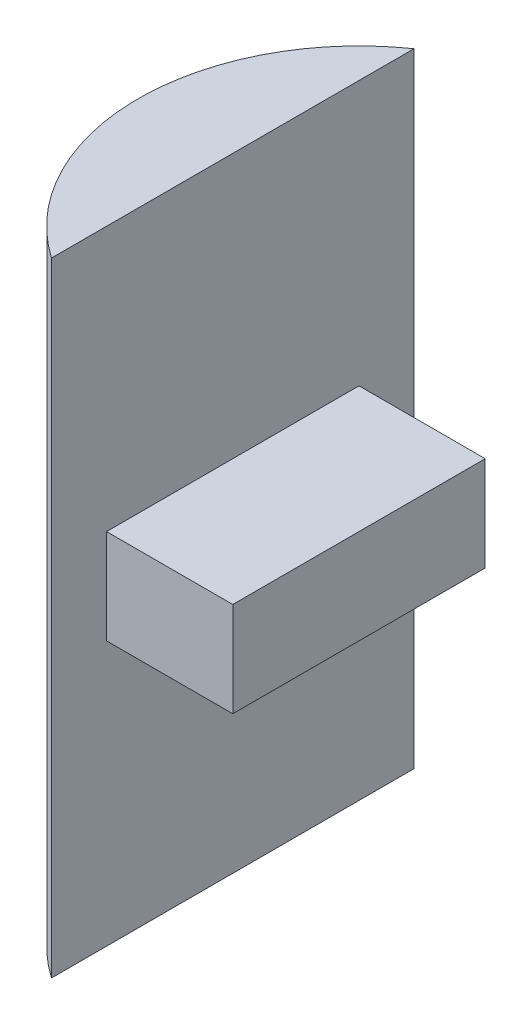
from build123d import *

# Parameters (mm, degrees)
SKETCH_1_R               = 2.5
EXTRUDE_1_DEPTH          = 23.88
SKETCH_2_R               = 1
EXTRUDE_2_DEPTH          = 1
CUT_EXTRUDE_1_DEPTH      = 5
CUT_EXTRUDE_START        = 18.88
CUT_EXTRUDE_2_DEPTH      = 5
SKETCH_6_R               = 0.25
CUT_EXTRUDE_3_DEPTH      = 0.25
CUT_EXTRUDE_START_2      = 5.25
SKETCH_7_R               = 0.25
CUT_EXTRUDE_4_DEPTH      = 0.25
EXTRUDE_START            = 7
SKETCH_17_R              = 3.5
EXTRUDE_5_DEPTH          = 9.88
CUT_EXTRUDE_6_DEPTH      = 26.937509518
CUT_EXTRUDE_6_DEPTH_BACK = 26.937509518
SKETCH_20_OUTSIDE_W      = 20.616
SKETCH_20_OUTSIDE_H      = 31.496
SKETCH_20_OUTSIDE_W_2    = 7
SKETCH_20_OUTSIDE_H_2    = 9.88
CUT_EXTRUDE_7_DEPTH      = 18.590747568
CUT_EXTRUDE_7_DEPTH_BACK = 18.590747568
SKETCH_22_W              = 5.5
SKETCH_22_H              = 9.88
EXTRUDE_START_2          = -2
SKETCH_24_W              = 4
SKETCH_24_H              = 1.5
EXTRUDE_6_DEPTH          = 2


with BuildPart() as part:
    # 草图1 → 凸台-拉伸1 (new body)
    with BuildSketch(Plane(origin=(0, 0, 0), x_dir=(1, 0, 0), z_dir=(0, 1, 0))):
        with Locations(Location((0, 0, 0), (0, 0, 90))):
            Circle(SKETCH_1_R)
    extrude(amount=EXTRUDE_1_DEPTH)

    # 草图2 → 凸台-拉伸2 (add)
    with BuildSketch(Plane(origin=(0, 0, 0), x_dir=(1, 0, 0), z_dir=(0, 1, 0))):
        with BuildLine():
            Line((0.166666667, 2.494438258), (7.633333333, 1.995550606))
            ThreePointArc((7.633333333, 1.995550606), (9.5, 0), (7.633333333, -1.995550606))
            Line((7.633333333, -1.995550606), (0.166666667, -2.494438258))
            ThreePointArc((0.166666667, -2.494438258), (-2.5, 0), (0.166666667, 2.494438258))
        make_face()
        with Locations(Location((7.5, 0, 0), (0, 0, 270))):
            Circle(SKETCH_2_R, mode=Mode.SUBTRACT)
    extrude(amount=EXTRUDE_2_DEPTH)

    # 草图3 → 切除-拉伸1 (cut)
    with BuildSketch(Plane(origin=(0, 0, 0), x_dir=(1, 0, 0), z_dir=(0, 1, 0))):
        with BuildLine():
            Line((-1.854049622, -0.75), (-0.75, -0.75))
            Line((-0.75, -0.75), (-0.75, -1.854049622))
            ThreePointArc((-0.75, -1.854049622), (0, -2), (0.75, -1.854049622))
            Line((0.75, -1.854049622), (0.75, -0.75))
            Line((0.75, -0.75), (1.854049622, -0.75))
            ThreePointArc((1.854049622, -0.75), (2, 0), (1.854049622, 0.75))
            Line((1.854049622, 0.75), (0.75, 0.75))
            Line((0.75, 0.75), (0.75, 1.854049622))
            ThreePointArc((0.75, 1.854049622), (0, 2), (-0.75, 1.854049622))
            Line((-0.75, 1.854049622), (-0.75, 0.75))
            Line((-0.75, 0.75), (-1.854049622, 0.75))
            ThreePointArc((-1.854049622, 0.75), (-2, 0), (-1.854049622, -0.75))
        make_face()
    extrude(amount=CUT_EXTRUDE_1_DEPTH, mode=Mode.SUBTRACT)

    # 草图5 → 切除-拉伸2 (cut)
    with BuildSketch(Plane(origin=(0, 0, 0), x_dir=(1, 0, 0), z_dir=(0, 1, 0)).offset(CUT_EXTRUDE_START)):
        with BuildLine():
            Line((1.854049622, 0.75), (0.75, 0.75))
            Line((0.75, 0.75), (0.75, 1.854049622))
            ThreePointArc((0.75, 1.854049622), (0, 2), (-0.75, 1.854049622))
            Line((-0.75, 1.854049622), (-0.75, 0.75))
            Line((-0.75, 0.75), (-1.854049622, 0.75))
            ThreePointArc((-1.854049622, 0.75), (-2, 0), (-1.854049622, -0.75))
            Line((-1.854049622, -0.75), (-0.75, -0.75))
            Line((-0.75, -0.75), (-0.75, -1.854049622))
            ThreePointArc((-0.75, -1.854049622), (0, -2), (0.75, -1.854049622))
            Line((0.75, -1.854049622), (0.75, -0.75))
            Line((0.75, -0.75), (1.854049622, -0.75))
            ThreePointArc((1.854049622, -0.75), (2, 0), (1.854049622, 0.75))
        make_face()
    extrude(amount=CUT_EXTRUDE_2_DEPTH, mode=Mode.SUBTRACT)

    # 草图6 → 切除-拉伸3 (cut)
    with BuildSketch(Plane(origin=(0, 0, 0), x_dir=(1, 0, 0), z_dir=(0, 1, 0)).offset(CUT_EXTRUDE_START)):
        with Locations(Location((0.75, 0, 0), (0, 0, 270))):
            Circle(SKETCH_6_R)
    extrude(amount=-CUT_EXTRUDE_3_DEPTH, mode=Mode.SUBTRACT)

    # 草图7 → 切除-拉伸4 (cut)
    with BuildSketch(Plane(origin=(0, 0, 0), x_dir=(1, 0, 0), z_dir=(0, 1, 0)).offset(CUT_EXTRUDE_START_2)):
        with Locations(Location((0.75, 0, 0), (0, 0, 270))):
            Circle(SKETCH_7_R)
    extrude(amount=-CUT_EXTRUDE_4_DEPTH, mode=Mode.SUBTRACT)

    # 草图17 → 凸台-拉伸5 (add)
    with BuildSketch(Plane(origin=(0, 0, 0), x_dir=(1, 0, 0), z_dir=(0, 1, 0)).offset(EXTRUDE_START)):
        with Locations(Location((0, 0, 0), (0, 0, 270))):
            Circle(SKETCH_17_R)
    extrude(amount=EXTRUDE_5_DEPTH)

    # 草图20 outside → 切除-拉伸6 (cut, two sides: drawn at the far end of the back side and taken through both)
    with BuildSketch(Plane.XY.offset(-CUT_EXTRUDE_6_DEPTH_BACK)):
        with Locations((3, 11.94)):
            Rectangle(SKETCH_20_OUTSIDE_W, SKETCH_20_OUTSIDE_H)
        with Locations((0, 11.94)):
            Rectangle(SKETCH_20_OUTSIDE_W_2, SKETCH_20_OUTSIDE_H_2, mode=Mode.SUBTRACT)
    extrude(amount=CUT_EXTRUDE_6_DEPTH + CUT_EXTRUDE_6_DEPTH_BACK, mode=Mode.SUBTRACT)

    # 草图22 → 切除-拉伸7 (cut, two sides: drawn at the far end of the back side and taken through both)
    with BuildSketch(Plane.XY.offset(-CUT_EXTRUDE_7_DEPTH_BACK)):
        with Locations((0.75, 11.94)):
            Rectangle(SKETCH_22_W, SKETCH_22_H)
    extrude(amount=CUT_EXTRUDE_7_DEPTH + CUT_EXTRUDE_7_DEPTH_BACK, mode=Mode.SUBTRACT)

    # 草图24 → 凸台-拉伸6 (add)
    with BuildSketch(Plane(origin=(0, 0, 0), x_dir=(0, 0, -1), z_dir=(1, 0, 0)).offset(EXTRUDE_START_2)):
        with Locations((0, 11.94)):
            Rectangle(SKETCH_24_W, SKETCH_24_H)
    extrude(amount=EXTRUDE_6_DEPTH)


solid = part.part
